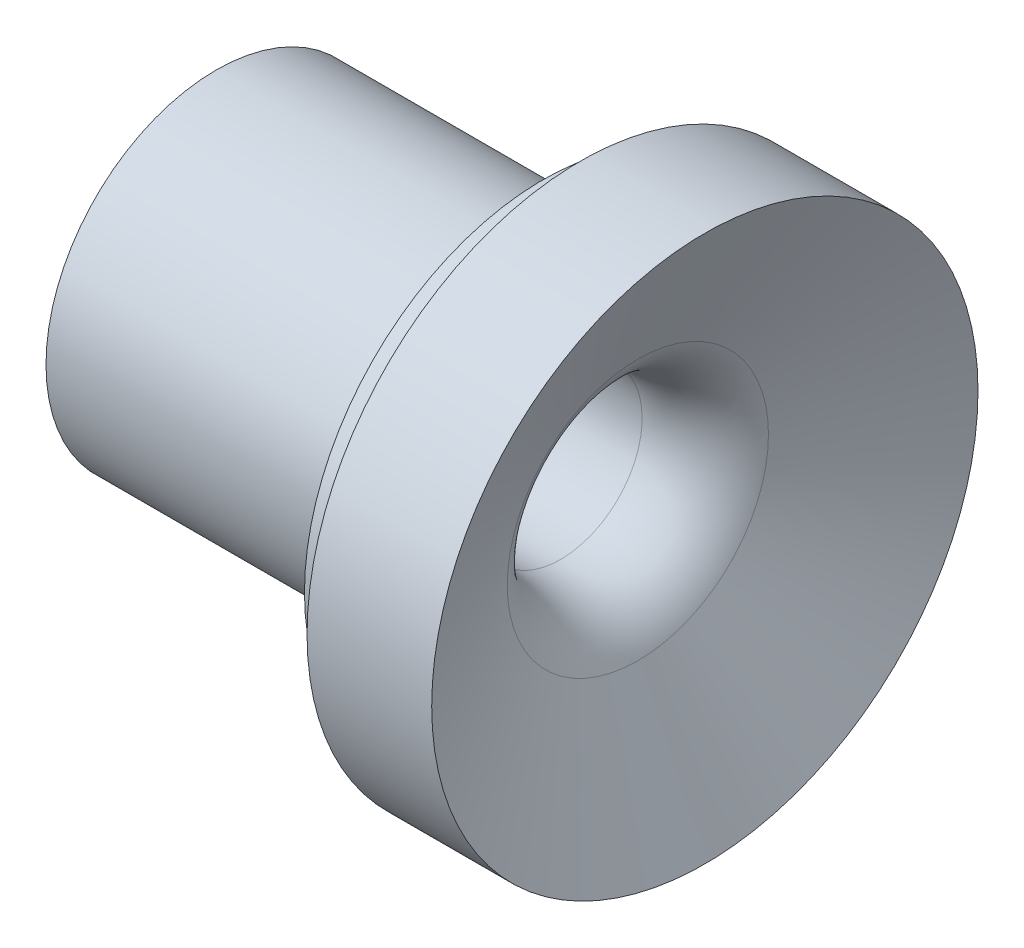
from build123d import *


with BuildPart() as part:
    # Esquisse1 → Révolution1 (revolve)
    with BuildSketch(Plane.XY, mode=Mode.PRIVATE) as r_volution1_sk:
        with BuildLine():
            Line((1.981656821, 8.97797736), (7.823456821, 8.97797736))
            Line((7.823456821, 8.97797736), (4.683813218, 2.298439639))
            ThreePointArc((4.683813218, 2.298439639), (3.207806254, 0.623149289), (1.06377284, 0))
            Line((1.06377284, 0), (0.803456821, 0))
            Line((0.803456821, 0), (-5.036543179, 0))
            Line((-5.036543179, 0), (-15.076543179, 1.81597736))
            Line((-15.076543179, 1.81597736), (-15.076543179, 4.15197736))
            Line((-15.076543179, 4.15197736), (-2.000513414, 4.15197736))
            ThreePointArc((-2.000513414, 4.15197736), (-1.65849327, 4.212284739), (-1.357725804, 4.385932917))
            Line((-1.357725804, 4.385932917), (-0.12815557, 5.417664847))
            ThreePointArc((-0.12815557, 5.417664847), (0.135364608, 5.761091028), (0.229056821, 6.18370929))
            Line((0.229056821, 6.18370929), (0.229056821, 7.34597736))
            Line((0.229056821, 7.34597736), (1.981656821, 7.34597736))
            Line((1.981656821, 7.34597736), (1.981656821, 8.97797736))
        make_face()
    revolve(r_volution1_sk.sketch.rotate(Axis((-19.476947674, -3.82202264, 0), (1, 0, 0)), 90), axis=Axis((-19.476947674, -3.82202264, 0), (1, 0, 0)))


solid = part.part
